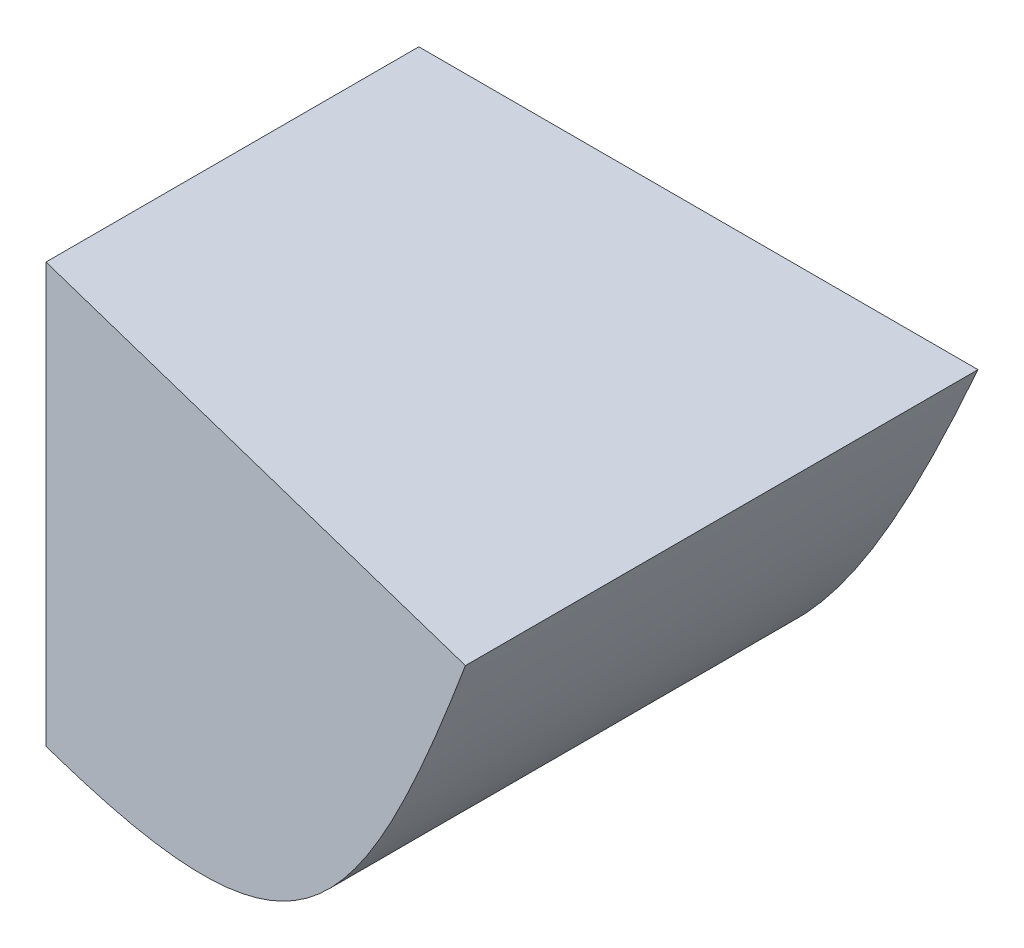
from build123d import *

# Parameters (mm, degrees)
FEATURE_PRISM_DEPTH = 14
FEATURE_TRIM_DEPTH  = 28.202941187


with BuildPart() as part:
    # profile:rational → feature:prism (new body)
    with BuildSketch(Plane.XY):
        with BuildLine():
            Line((12, 9), (0, 9))
            Line((0, 9), (0, 0))
            add(Edge.make_bspline(
                [(0, 0), (4, 0), (8, 0), (12, 9)],
                knots=[0, 0, 0, 0, 1, 1, 1, 1], degree=3, weights=[1, 0.75, 1.25, 1]))
        make_face()
    extrude(amount=FEATURE_PRISM_DEPTH)

    # profile:cut → feature:trim (cut, through all)
    with BuildSketch(Plane.XZ.offset(-20)):
        Polygon((-2, 7.5), (14, 11.5), (14, 20), (-2, 20), align=None)
    extrude(amount=FEATURE_TRIM_DEPTH, mode=Mode.SUBTRACT)


solid = part.part
